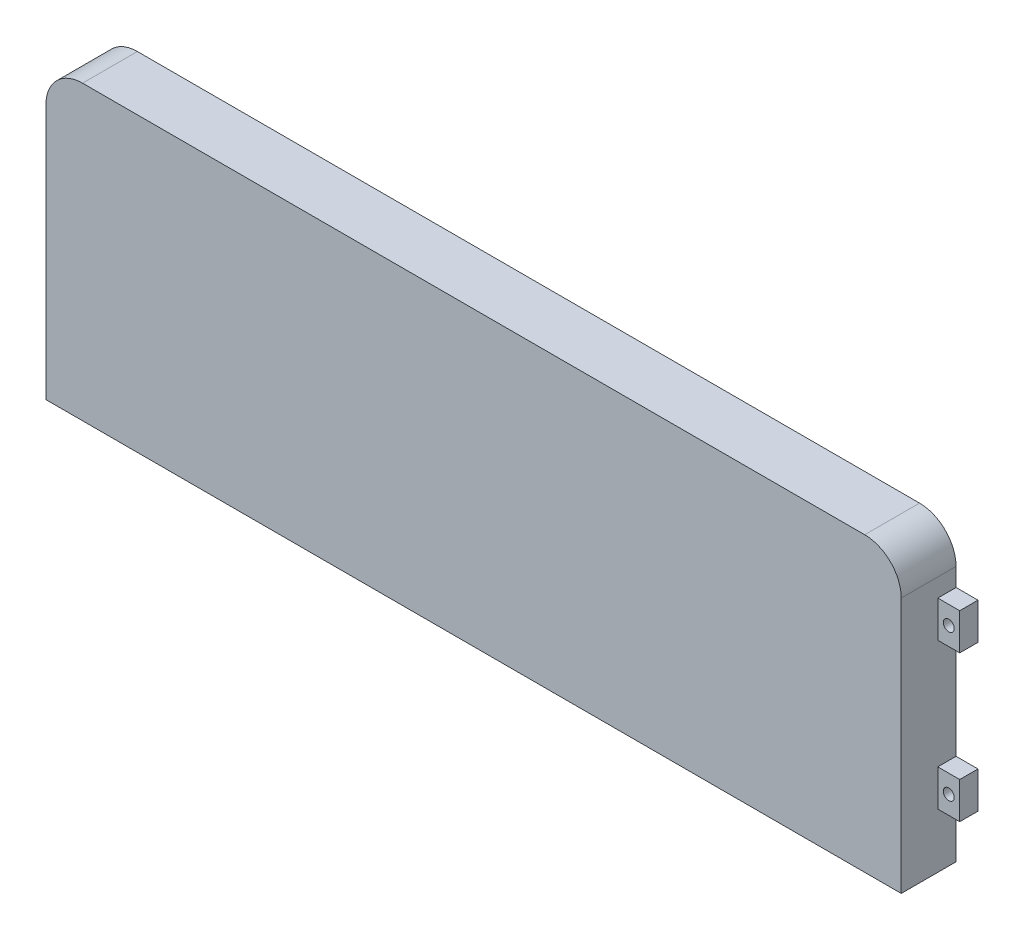
from build123d import *

# Parameters (mm, degrees)
BOSS_EXTRU_1_DEPTH      = 15
COQUE1_T                = -3
ESQUISSE3_W             = 228
ESQUISSE3_H             = 3
ENL_V_MAT_EXTRU_2_DEPTH = 12
BOSS_EXTRU_3_DEPTH      = 5
BOSS_EXTRU_4_DEPTH      = 5
ESQUISSE2_W             = 6
ESQUISSE2_H             = 10
ESQUISSE2_R             = 1.5
BOSS_EXTRU_6_DEPTH      = 5


with BuildPart() as part:
    # Esquisse1 → Boss.-Extru.1 (new body)
    with BuildSketch(Plane.XY):
        with BuildLine():
            Line((-107, 40), (107, 40))
            ThreePointArc((107, 40), (114.071067812, 37.071067812), (117, 30))
            Line((117, 30), (117, -40))
            Line((117, -40), (-117, -40))
            Line((-117, -40), (-117, 30))
            ThreePointArc((-117, 30), (-114.071067812, 37.071067812), (-107, 40))
        make_face()
    extrude(amount=BOSS_EXTRU_1_DEPTH)

    # Coque1
    coque1_openings = [part.faces().sort_by_distance(p)[0] for p in [
        (0, -0.086787891, 0),
    ]]
    offset(amount=COQUE1_T, openings=coque1_openings, kind=Kind.INTERSECTION)

    # Esquisse3 → Enlèv. mat.-Extru.2 (cut)
    with BuildSketch(Plane(origin=(0, 0, 0), x_dir=(-1, 0, 0), z_dir=(0, 0, -1))):
        with Locations((0, -38.5)):
            Rectangle(ESQUISSE3_W, ESQUISSE3_H)
    extrude(amount=-ENL_V_MAT_EXTRU_2_DEPTH, mode=Mode.SUBTRACT)

    # Esquisse4 → Boss.-Extru.3 (add)
    with BuildSketch(Plane.ZY.offset(-114)):
        Polygon((0, -40), (0, 30), (5, 30), (5, -40), (3.75, -40), (3.75, 28.5), (1.25, 28.5), (1.25, -40), align=None)
    boss_extru_3 = extrude(amount=BOSS_EXTRU_3_DEPTH)

    # Symétrie1: Boss.-Extru.3 across plane
    add(boss_extru_3.mirror(Plane(origin=(0, 0, 0), x_dir=(0, 0, 1), z_dir=(1, 0, 0))))

    # Esquisse5 → Boss.-Extru.4 (add)
    with BuildSketch(Plane(origin=(0, 0, 0), x_dir=(-1, 0, 0), z_dir=(0, 0, -1))):
        with BuildLine():
            Line((-107, 37), (107, 37))
            ThreePointArc((107, 37), (111.949747468, 34.949747468), (114, 30))
            Line((114, 30), (-114, 30))
            ThreePointArc((-114, 30), (-111.949747468, 34.949747468), (-107, 37))
        make_face()
    extrude(amount=-BOSS_EXTRU_4_DEPTH)

    # Esquisse2 → Boss.-Extru.6 (add)
    # profile 1 of 4: a face of its own
    with BuildSketch(Plane(origin=(0, 0, 0), x_dir=(-1, 0, 0), z_dir=(0, 0, -1))):
        with Locations((-120, -20)):
            Rectangle(ESQUISSE2_W, ESQUISSE2_H)
        with Locations((-120, -20)):
            Circle(ESQUISSE2_R, mode=Mode.SUBTRACT)
    # profile 2 of 4: a face of its own
    with BuildSketch(Plane(origin=(0, 0, 0), x_dir=(-1, 0, 0), z_dir=(0, 0, -1))):
        with Locations((-120, 20)):
            Rectangle(ESQUISSE2_W, ESQUISSE2_H)
        with Locations((-120, 20)):
            Circle(ESQUISSE2_R, mode=Mode.SUBTRACT)
    # profile 3 of 4: a face of its own
    with BuildSketch(Plane(origin=(0, 0, 0), x_dir=(-1, 0, 0), z_dir=(0, 0, -1))):
        with Locations((120, 20)):
            Rectangle(ESQUISSE2_W, ESQUISSE2_H)
        with Locations((120, 20)):
            Circle(ESQUISSE2_R, mode=Mode.SUBTRACT)
    # profile 4 of 4: a face of its own
    with BuildSketch(Plane(origin=(0, 0, 0), x_dir=(-1, 0, 0), z_dir=(0, 0, -1))):
        with Locations((120, -20)):
            Rectangle(ESQUISSE2_W, ESQUISSE2_H)
        with Locations((120, -20)):
            Circle(ESQUISSE2_R, mode=Mode.SUBTRACT)
    extrude(amount=-BOSS_EXTRU_6_DEPTH)


solid = part.part
